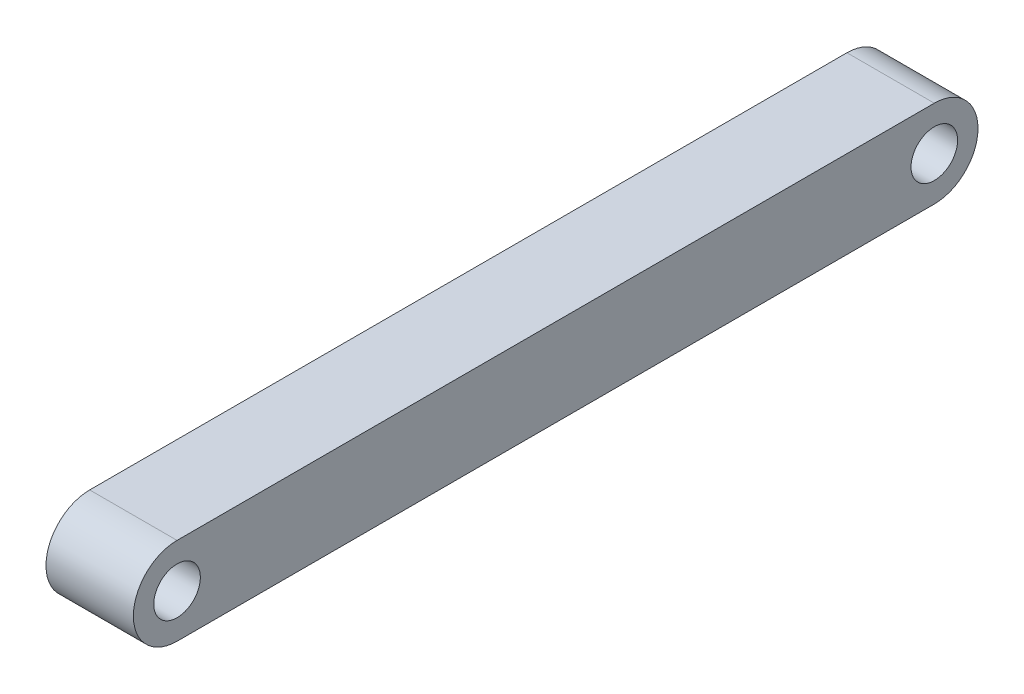
from build123d import *

# Parameters (mm, degrees)
SKETCH1_R           = 4
BOSS_EXTRUDE1_DEPTH = 7.5


with BuildPart() as part:
    # Sketch1 → Boss-Extrude1 (new, symmetric)
    with BuildSketch(Plane(origin=(0, 0, 0), x_dir=(0, 0, -1), z_dir=(1, 0, 0))):
        with BuildLine():
            Line((-65, 7.5), (65, 7.5))
            ThreePointArc((65, 7.5), (72.5, 0), (65, -7.5))
            Line((65, -7.5), (-65, -7.5))
            ThreePointArc((-65, -7.5), (-72.5, 0), (-65, 7.5))
        make_face()
        with Locations((-65, 0)):
            Circle(SKETCH1_R, mode=Mode.SUBTRACT)
        with Locations((65, 0)):
            Circle(SKETCH1_R, mode=Mode.SUBTRACT)
    extrude(amount=BOSS_EXTRUDE1_DEPTH, both=True)


solid = part.part
